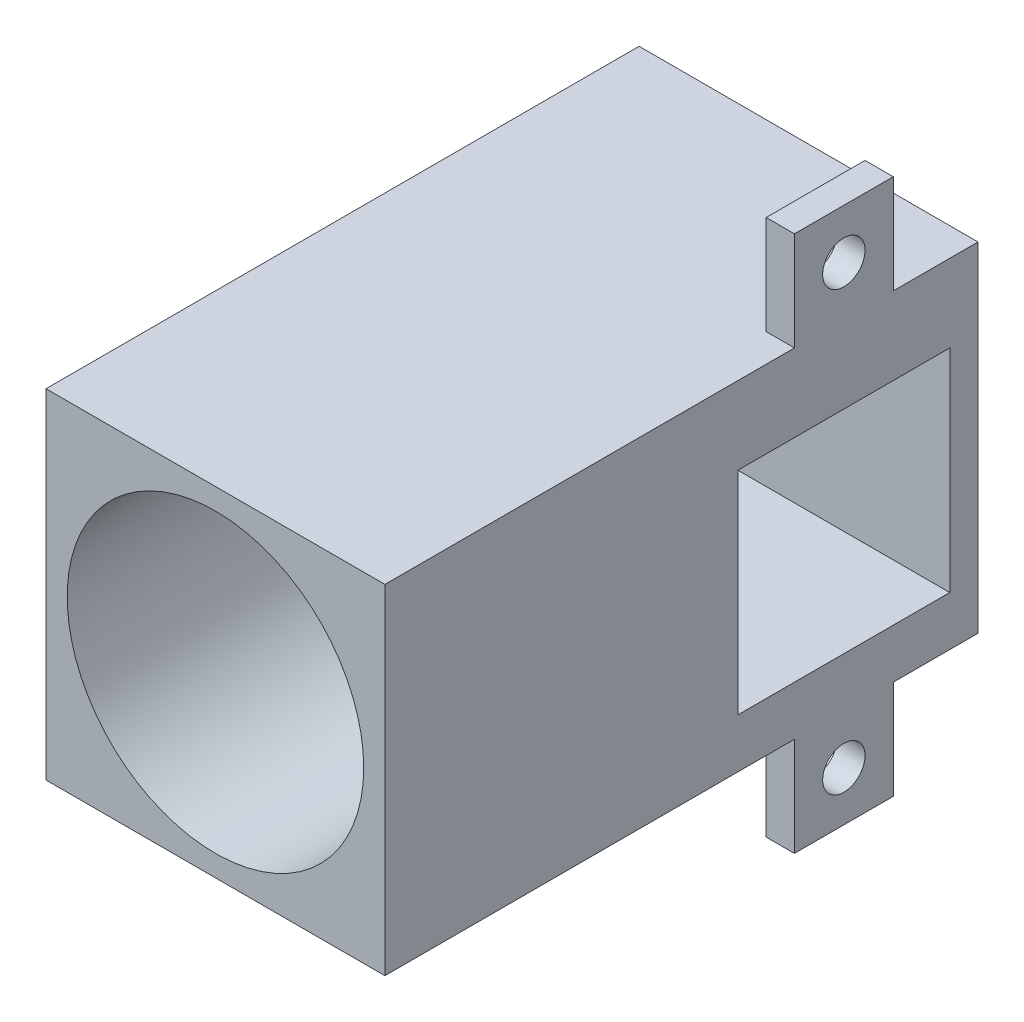
from build123d import *

# Parameters (mm, degrees)
SKETCH_1_W          = 24
SKETCH_1_H          = 24
EXTRUDE_1_DEPTH     = 42
SKETCH_3_R          = 10.5
CUT_EXTRUDE_1_DEPTH = 20
SKETCH_4_W          = 17
SKETCH_4_H          = 17
CUT_EXTRUDE_2_DEPTH = 20
SKETCH_5_W          = 15
SKETCH_5_H          = 15
CUT_EXTRUDE_5_DEPTH = 50.839743178
SKETCH_6_W          = 7
SKETCH_6_H          = 7
SKETCH_6_R          = 1.5
EXTRUDE_2_DEPTH     = 2


with BuildPart() as part:
    # Эскиз1 → Бобышка-Вытянуть1 (new body)
    with BuildSketch(Plane.XY):
        Rectangle(SKETCH_1_W, SKETCH_1_H)
    extrude(amount=EXTRUDE_1_DEPTH)

    # Эскиз3 → Вырез-Вытянуть1 (cut)
    with BuildSketch(Plane.XY.offset(42)):
        Circle(SKETCH_3_R)
    extrude(amount=-CUT_EXTRUDE_1_DEPTH, mode=Mode.SUBTRACT)

    # Эскиз4 → Вырез-Вытянуть2 (cut)
    with BuildSketch(Plane.XY.offset(22)):
        Rectangle(SKETCH_4_W, SKETCH_4_H)
    extrude(amount=-CUT_EXTRUDE_2_DEPTH, mode=Mode.SUBTRACT)

    # Эскиз5 → Вырез-Вытянуть5 (cut, through all)
    with BuildSketch(Plane(origin=(12, 0, 0), x_dir=(0, 0, -1), z_dir=(1, 0, 0))):
        with Locations((-9.5, -1)):
            Rectangle(SKETCH_5_W, SKETCH_5_H)
    extrude(amount=-CUT_EXTRUDE_5_DEPTH, mode=Mode.SUBTRACT)

    # Эскиз6 → Бобышка-Вытянуть2 (add)
    # profile 1 of 2: a face of its own
    with BuildSketch(Plane(origin=(12, 0, 0), x_dir=(0, 0, -1), z_dir=(1, 0, 0))):
        with Locations((-9.5, 15.5)):
            Rectangle(SKETCH_6_W, SKETCH_6_H)
        with Locations((-9.5, 15.5)):
            Circle(SKETCH_6_R, mode=Mode.SUBTRACT)
    # profile 2 of 2: a face of its own
    with BuildSketch(Plane(origin=(12, 0, 0), x_dir=(0, 0, -1), z_dir=(1, 0, 0))):
        with Locations((-9.5, -15.5)):
            Rectangle(SKETCH_6_W, SKETCH_6_H)
        with Locations((-9.5, -15.5)):
            Circle(SKETCH_6_R, mode=Mode.SUBTRACT)
    extrude(amount=-EXTRUDE_2_DEPTH)


solid = part.part
